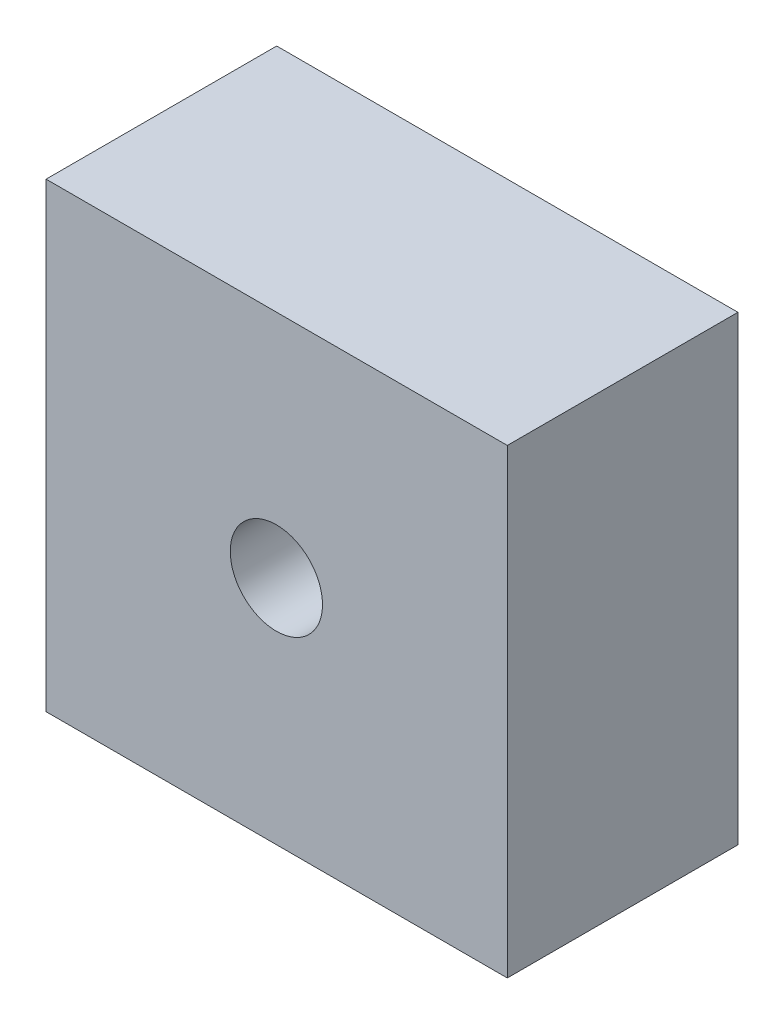
from build123d import *

# Parameters (mm, degrees)
SKETCH_1_W      = 20
SKETCH_1_H      = 20
BASEBOX_DEPTH   = 10
HOLE_WIZARD_1_D = 4


with BuildPart() as part:
    # 草图1 → BaseBox (new body)
    with BuildSketch(Plane.XY):
        with Locations((10, 10)):
            Rectangle(SKETCH_1_W, SKETCH_1_H)
    extrude(amount=BASEBOX_DEPTH)

    # 孔1 (through all)
    with Locations(Plane.XY.offset(10)):
        with Locations((9.986487375, 10.014305599)):
            Hole(HOLE_WIZARD_1_D / 2)


solid = part.part
